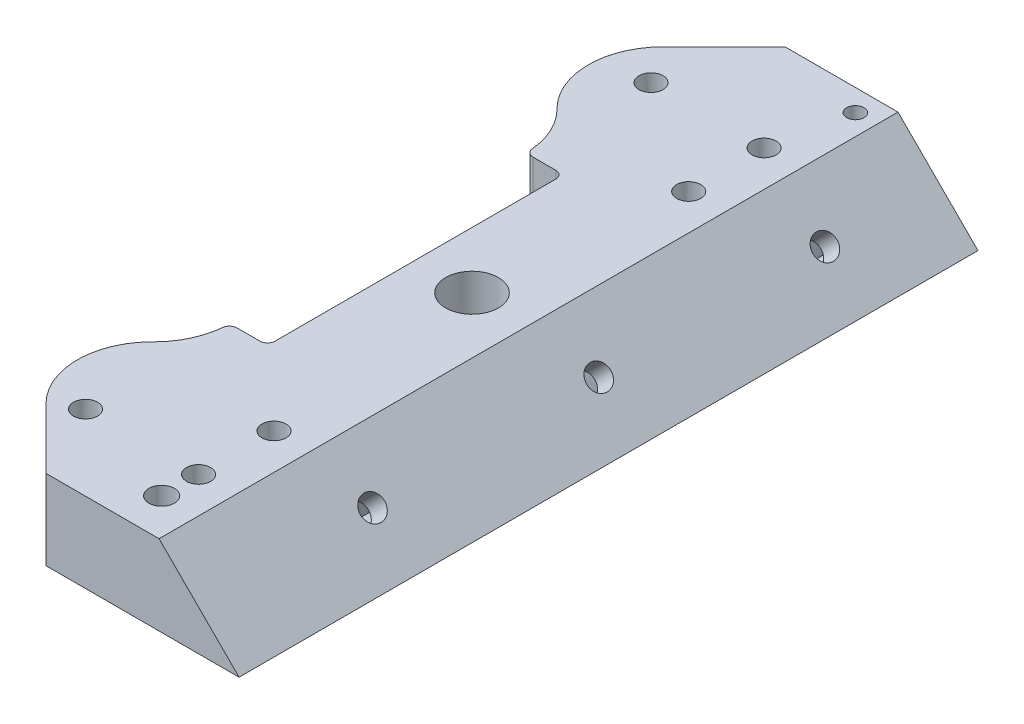
from build123d import *

# Parameters (mm, degrees)
EXTRUDE1_DEPTH      = 98
SKETCH2_R           = 1.6
EXTRUDE2_DEPTH      = 98
SKETCH3_R           = 1.6
EXTRUDE3_DEPTH      = 107.608611768
SKETCH5_W           = 16
SKETCH5_H           = 19.339886244
EXTRUDE4_DEPTH      = 14
EXTRUDE5_DEPTH      = 14
CHAMFER1_SIZE       = 15
SKETCH8_W           = 13.873619141
SKETCH8_H           = 12.242705067
EXTRUDE6_DEPTH      = 24
SKETCH_1_R          = 1.6
CUT_EXTRUDE_1_DEPTH = 18
CUT_EXTRUDE_2_DEPTH = 21
FILLET_1_R          = 10
SKETCH_3_W          = 5
SKETCH_3_H          = 39.245169096
CUT_EXTRUDE_3_DEPTH = 36
FILLET_2_R          = 1
CUT_EXTRUDE_4_DEPTH = 36
SKETCH_5_R          = 3.5
CUT_EXTRUDE_5_DEPTH = 27
SKETCH_6_R          = 1.15
CUT_EXTRUDE_6_DEPTH = 17
SKETCH_7_R          = 1.6
CUT_EXTRUDE_7_DEPTH = 23
SKETCH_8_R          = 1.6
CUT_EXTRUDE_8_DEPTH = 19
SKETCH_9_R          = 1.7
CUT_EXTRUDE_9_DEPTH = 15


with BuildPart() as part:
    # Sketch1 → Extrude1 (new body)
    with BuildSketch(Plane.XY):
        Polygon((0, 0), (0, -10.606601718), (40.606601718, -10.606601718), (30, 0), align=None)
    extrude(amount=EXTRUDE1_DEPTH)

    # Sketch2 → Extrude2 (cut)
    with BuildSketch(Plane(origin=(15, 15, 0), x_dir=(0, 0, -1), z_dir=(0.7071067811865487, 0.7071067811865465, 0))):
        with Locations(Location((-75, -28.713203436, 0), (0, 0, 90))):
            Circle(SKETCH2_R)
        with Locations(Location((-45, -28.713203436, 0), (0, 0, 90))):
            Circle(SKETCH2_R)
        with Locations(Location((-15, -28.713203436, 0), (0, 0, 90))):
            Circle(SKETCH2_R)
    extrude(amount=-EXTRUDE2_DEPTH, mode=Mode.SUBTRACT)

    # Sketch3 → Extrude3 (cut, through all)
    with BuildSketch(Plane(origin=(0, 0, 0), x_dir=(1, 0, 0), z_dir=(0, 1, 0))):
        with Locations(Location((25.24, -13, 0), (0, 0, 270))):
            Circle(SKETCH3_R)
        with Locations(Location((25.24, -88, 0), (0, 0, 270))):
            Circle(SKETCH3_R)
    extrude(amount=-EXTRUDE3_DEPTH, mode=Mode.SUBTRACT)

    # Sketch5 → Extrude4 (cut)
    with BuildSketch(Plane(origin=(0, 0, 0), x_dir=(1, 0, 0), z_dir=(0, 1, 0))):
        with Locations((2, -35)):
            Rectangle(SKETCH5_W, SKETCH5_H)
    extrude4 = extrude(amount=-EXTRUDE4_DEPTH, mode=Mode.SUBTRACT)

    # Sketch6 → Extrude5 (cut)
    with BuildSketch(Plane(origin=(12.878679656, 12.878679656, 0), x_dir=(0, 0, -1), z_dir=(0.7071067811865487, 0.7071067811865465, 0))):
        Polygon((-18.293925969, -28.110389168), (-17.169015454, -31.264419869), (-13.875089485, -31.867234137), (-11.706074031, -29.316017703), (-12.830984546, -26.161987002), (-16.124910515, -25.559172734), align=None)
        Polygon((-48.088943289, -27.420236812), (-47.664213587, -30.741823483), (-44.575270298, -32.034790107), (-41.911056711, -30.006170059), (-42.335786413, -26.684583388), (-45.424729702, -25.391616765), align=None)
        Polygon((-78.340699378, -28.482853703), (-76.869838409, -31.491159097), (-73.529139031, -31.72150883), (-71.659300622, -28.943553168), (-73.130161591, -25.935247774), (-76.470860969, -25.704898042), align=None)
    extrude(amount=-EXTRUDE5_DEPTH, mode=Mode.SUBTRACT)

    # Mirror1: Extrude4 across plane
    add(extrude4.mirror(Plane(origin=(0, 0, 49), x_dir=(1, 0, 0), z_dir=(0, 0, -1))), mode=Mode.SUBTRACT)

    # Chamfer1
    chamfer1_edges = [part.edges().sort_by_distance(p)[0] for p in [
        (0, -5.303300859, 98),
        (0, -5.303300859, 0),
    ]]
    chamfer(chamfer1_edges, length=CHAMFER1_SIZE)

    # Sketch8 → Extrude6 (cut)
    with BuildSketch(Plane(origin=(0, 0, 0), x_dir=(1, 0, 0), z_dir=(0, 1, 0))):
        with Locations((3.063190429, -47.208704345)):
            Rectangle(SKETCH8_W, SKETCH8_H)
    extrude(amount=-EXTRUDE6_DEPTH, mode=Mode.SUBTRACT)

    # 草图1 → 切除-拉伸1 (cut)
    with BuildSketch(Plane(origin=(0, 0, 0), x_dir=(1, 0, 0), z_dir=(0, 1, 0))):
        with Locations(Location((25.24, -13, 0), (0, 0, 270))):
            Circle(SKETCH_1_R)
        with Locations(Location((10.24, -13, 0), (0, 0, 270))):
            Circle(SKETCH_1_R)
        with Locations(Location((10.24, -88, 0), (0, 0, 270))):
            Circle(SKETCH_1_R)
    extrude(amount=-CUT_EXTRUDE_1_DEPTH, mode=Mode.SUBTRACT)

    # 草图2 → 切除-拉伸2 (cut)
    with BuildSketch(Plane(origin=(0, 0, 0), x_dir=(1, 0, 0), z_dir=(0, 1, 0))):
        Polygon((10, -72.669943122), (0, -83), (0, -72.669943122), align=None)
        Polygon((10, -25.330056878), (0, -15), (0, -25.330056878), align=None)
    extrude(amount=-CUT_EXTRUDE_2_DEPTH, mode=Mode.SUBTRACT)

    # 圆角1
    fillet_1_edges = [part.edges().sort_by_distance(p)[0] for p in [
        (10, -5.303300859, 72.669943122),
        (0, -5.303300859, 83),
        (0, -5.303300859, 15),
        (10, -5.303300859, 25.330056878),
    ]]
    fillet(fillet_1_edges, radius=FILLET_1_R)

    # 草图3 → 切除-拉伸3 (cut)
    with BuildSketch(Plane(origin=(0, 0, 0), x_dir=(1, 0, 0), z_dir=(0, 1, 0))):
        with Locations((12.5, -49)):
            Rectangle(SKETCH_3_W, SKETCH_3_H)
    extrude(amount=-CUT_EXTRUDE_3_DEPTH, mode=Mode.SUBTRACT)

    # 圆角2
    fillet_2_edges = [part.edges().sort_by_distance(p)[0] for p in [
        (10, -5.303300859, 29.377415452),
        (10, -5.303300859, 68.622584548),
        (15, -5.303300859, 29.377415452),
        (15, -5.303300859, 68.622584548),
    ]]
    fillet(fillet_2_edges, radius=FILLET_2_R)

    # 草图4 → 切除-拉伸4 (cut)
    with BuildSketch(Plane(origin=(0, 0, 0), x_dir=(1, 0, 0), z_dir=(0, 1, 0))):
        Polygon((24.462990915, -49), (23.481495458, -47.3), (21.518504542, -47.3), (20.537009085, -49), (21.518504542, -50.7), (23.481495458, -50.7), align=None)
    extrude(amount=-CUT_EXTRUDE_4_DEPTH, mode=Mode.SUBTRACT)

    # 草图5 → 切除-拉伸5 (cut)
    with BuildSketch(Plane(origin=(0, 0, 0), x_dir=(1, 0, 0), z_dir=(0, 1, 0))):
        with Locations(Location((22.5, -49, 0), (0, 0, 270))):
            Circle(SKETCH_5_R)
    extrude(amount=-CUT_EXTRUDE_5_DEPTH, mode=Mode.SUBTRACT)

    # 草图6 → 切除-拉伸6 (cut)
    with BuildSketch(Plane(origin=(0, 0, 0), x_dir=(1, 0, 0), z_dir=(0, 1, 0))):
        with Locations(Location((27.24, -2.9, 0), (0, 0, 270))):
            Circle(SKETCH_6_R)
    extrude(amount=-CUT_EXTRUDE_6_DEPTH, mode=Mode.SUBTRACT)

    # 草图7 → 切除-拉伸7 (cut)
    with BuildSketch(Plane(origin=(0, 0, 0), x_dir=(1, 0, 0), z_dir=(0, 1, 0))):
        with Locations(Location((25.24, -78, 0), (0, 0, 270))):
            Circle(SKETCH_7_R)
    extrude(amount=-CUT_EXTRUDE_7_DEPTH, mode=Mode.SUBTRACT)

    # 草图8 → 切除-拉伸8 (cut)
    with BuildSketch(Plane(origin=(0, -10.606601718, 0), x_dir=(-1, 0, 0), z_dir=(0, -1, 0))):
        with Locations(Location((-25.24, -23, 0), (0, 0, 180))):
            Circle(SKETCH_8_R)
    extrude(amount=-CUT_EXTRUDE_8_DEPTH, mode=Mode.SUBTRACT)

    # 草图9 → 切除-拉伸9 (cut)
    with BuildSketch(Plane(origin=(0, 0, 0), x_dir=(1, 0, 0), z_dir=(0, 1, 0))):
        with Locations(Location((25.24, -92.9, 0), (0, 0, 270))):
            Circle(SKETCH_9_R)
    extrude(amount=-CUT_EXTRUDE_9_DEPTH, mode=Mode.SUBTRACT)


solid = part.part
